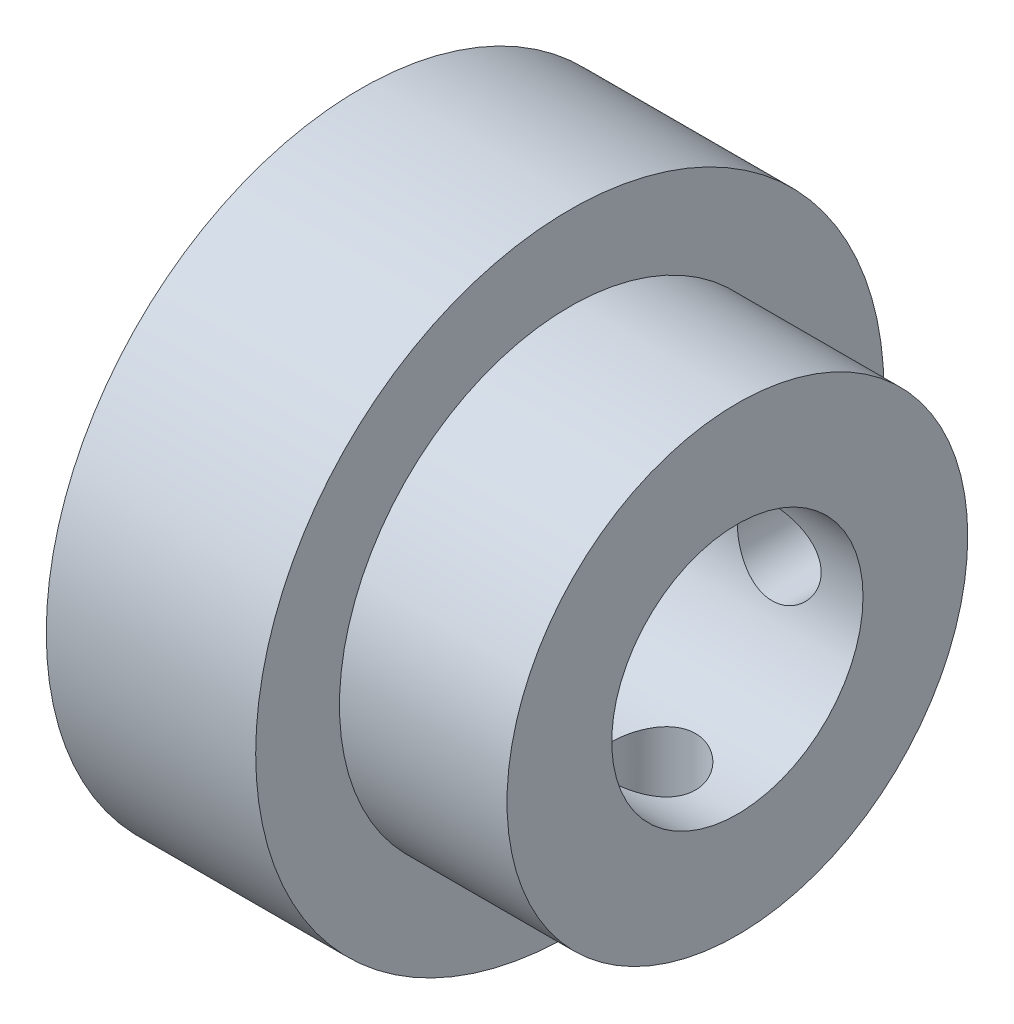
from build123d import *

# Parameters (mm, degrees)
SCHIZZO2_R               = 2
TAGLIO_ESTRUSIONE1_DEPTH = 33.921195442
SCHIZZO3_R               = 2
TAGLIO_ESTRUSIONE2_DEPTH = 33.921195518


with BuildPart() as part:
    # Schizzo1 → Rivoluzione1 (revolve)
    with BuildSketch(Plane.XY, mode=Mode.PRIVATE) as rivoluzione1_sk:
        Polygon((-25.175486278, 6), (-25.175486278, 15), (-15.175486278, 15), (-15.175486278, 11), (-7.175486278, 11), (-7.175486278, 6), align=None)
    revolve(rivoluzione1_sk.sketch.rotate(Axis((88.99, 0, 0), (-1, 0, 0)), 90), axis=Axis((88.99, 0, 0), (-1, 0, 0)))

    # Schizzo2 → Taglio-Estrusione1 (cut, through all)
    with BuildSketch(Plane.XY):
        with Locations((-11.175486278, 0)):
            Circle(SCHIZZO2_R)
    extrude(amount=-TAGLIO_ESTRUSIONE1_DEPTH, mode=Mode.SUBTRACT)

    # Schizzo3 → Taglio-Estrusione2 (cut, through all)
    with BuildSketch(Plane(origin=(0, 0, 0), x_dir=(1, 0, 0), z_dir=(0, 1, 0))):
        with Locations(Location((-11.175486278, 0, 0), (0, 0, 270))):
            Circle(SCHIZZO3_R)
    extrude(amount=-TAGLIO_ESTRUSIONE2_DEPTH, mode=Mode.SUBTRACT)


solid = part.part
